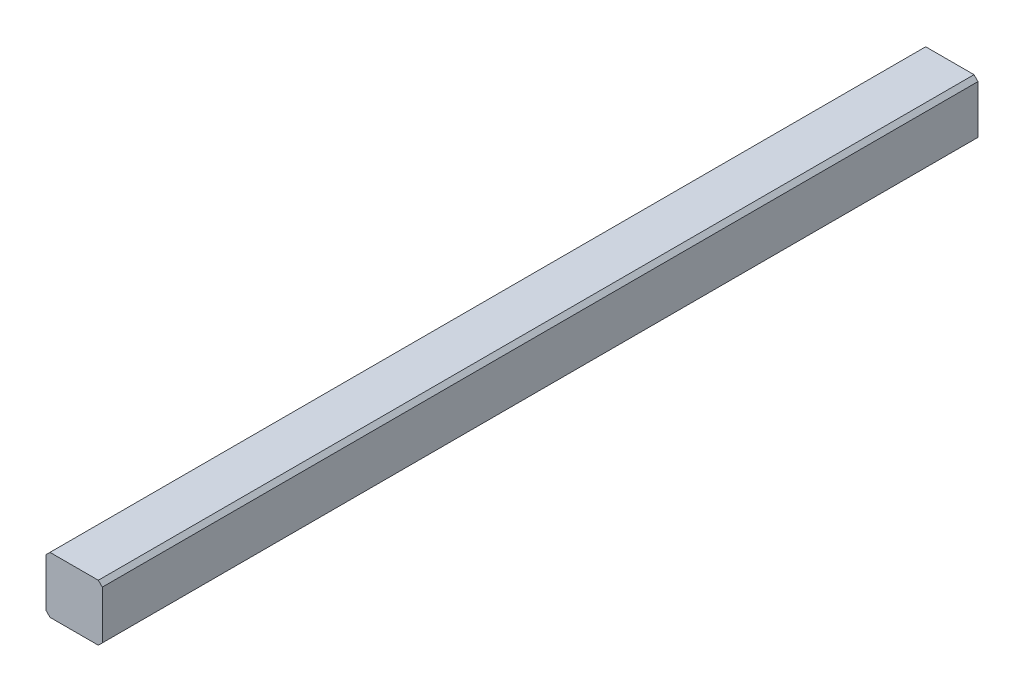
from build123d import *

# Parameters (mm, degrees)
SKETCH1_W           = 7.071067812
SKETCH1_H           = 7.071067812
BOSS_EXTRUDE1_DEPTH = 110
CHAMFER2_SIZE       = 0.5


with BuildPart() as part:
    # Sketch1 → Boss-Extrude1 (new body)
    with BuildSketch(Plane.XY):
        Rectangle(SKETCH1_W, SKETCH1_H)
    extrude(amount=BOSS_EXTRUDE1_DEPTH)

    # Chamfer2
    chamfer2_edges = [part.edges().sort_by_distance(p)[0] for p in [
        (-3.535533906, 3.535533906, 55),
        (3.535533906, 3.535533906, 55),
        (3.535533906, -3.535533906, 55),
        (-3.535533906, -3.535533906, 55),
    ]]
    chamfer(chamfer2_edges, length=CHAMFER2_SIZE)


solid = part.part
